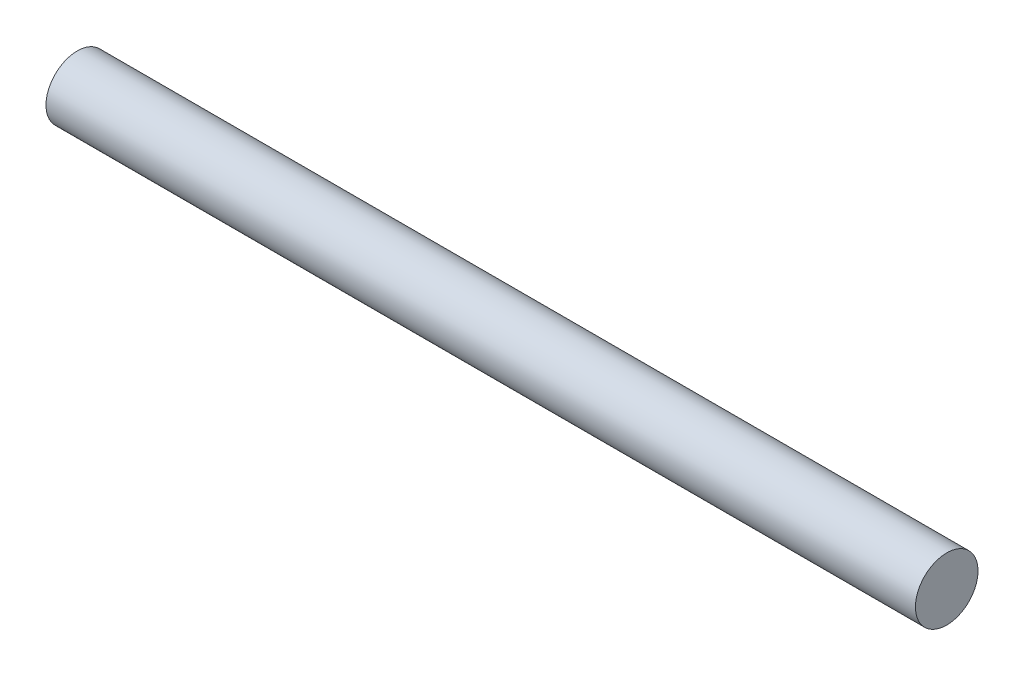
from build123d import *

# Parameters (mm, degrees)
SKETCH1_W = 500
SKETCH1_H = 18


with BuildPart() as part:
    # Sketch1 → Revolve1 (revolve)
    with BuildSketch(Plane.XY, mode=Mode.PRIVATE) as revolve1_sk:
        with Locations((0, 9)):
            Rectangle(SKETCH1_W, SKETCH1_H)
    revolve(revolve1_sk.sketch.rotate(Axis((-250, 0, 0), (1, 0, 0)), 180), axis=Axis((-250, 0, 0), (1, 0, 0)))


solid = part.part
